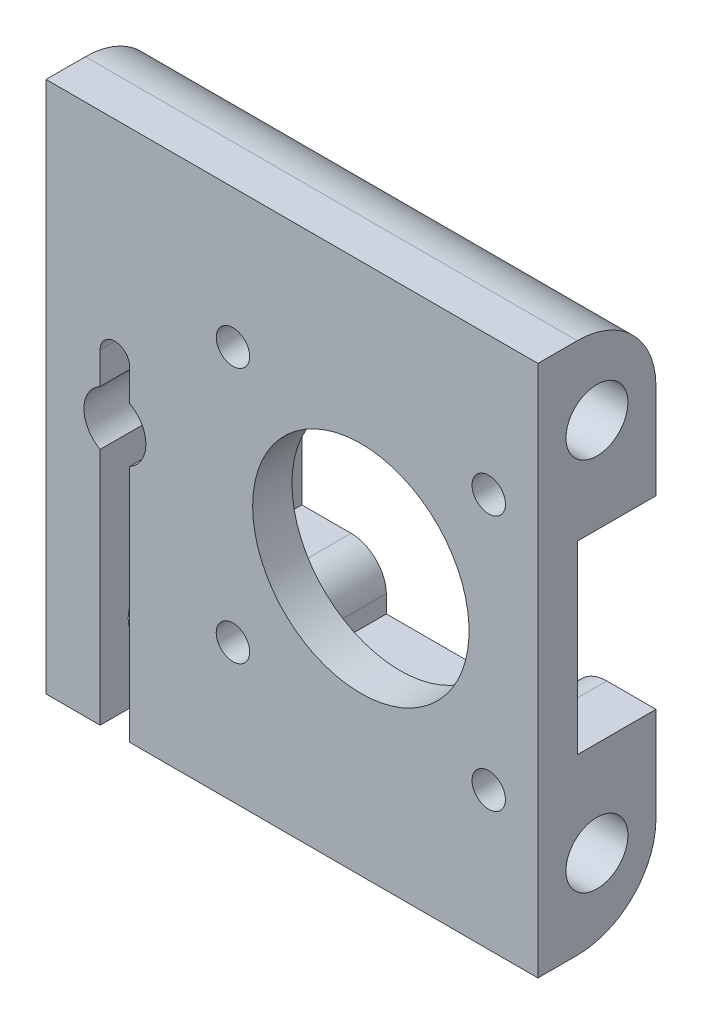
from build123d import *

# Parameters (mm, degrees)
SKETCH1_W           = 50
SKETCH1_H           = 54.105
BOSS_EXTRUDE1_DEPTH = 12
SKETCH2_R           = 3.15
CUT_EXTRUDE1_DEPTH  = 75.641483272
FILLET1_R           = 8
SKETCH3_R           = 11
SKETCH3_R_2         = 1.7
CUT_EXTRUDE2_DEPTH  = 75.641483272
CUT_EXTRUDE4_DEPTH  = 8


with BuildPart() as part:
    # Sketch1 → Boss-Extrude1 (new body)
    with BuildSketch(Plane.XY):
        with Locations((25, 27.0525)):
            Rectangle(SKETCH1_W, SKETCH1_H)
    extrude(amount=BOSS_EXTRUDE1_DEPTH)

    # Sketch2 → Cut-Extrude1 (cut, through all)
    with BuildSketch(Plane(origin=(0, 0, 0), x_dir=(0, 0, -1), z_dir=(1, 0, 0))):
        with Locations((-6, 46.105)):
            Circle(SKETCH2_R)
        with Locations(Location((-6, 8, 0), (0, 0, 180))):
            Circle(SKETCH2_R)
    extrude(amount=CUT_EXTRUDE1_DEPTH, mode=Mode.SUBTRACT)

    # Fillet1
    fillet1_edges = [part.edges().sort_by_distance(p)[0] for p in [
        (25, 54.105, 0),
        (25, 0, 0),
    ]]
    fillet(fillet1_edges, radius=FILLET1_R)

    # Sketch3 → Cut-Extrude2 (cut, through all)
    with BuildSketch(Plane(origin=(0, 0, 0), x_dir=(-1, 0, 0), z_dir=(0, 0, -1))):
        with Locations((-32, 27.0525)):
            Circle(SKETCH3_R)
        with Locations((-19, 40.0525)):
            Circle(SKETCH3_R_2)
        with Locations((-19, 14.0525)):
            Circle(SKETCH3_R_2)
        with Locations((-45, 14.0525)):
            Circle(SKETCH3_R_2)
        with Locations((-45, 40.0525)):
            Circle(SKETCH3_R_2)
        with BuildLine():
            Line((-8.5, 0), (-8.5, 24.282572203))
            ThreePointArc((-8.5, 24.282572203), (-10.15, 27.0525), (-8.5, 29.822427797))
            Line((-8.5, 29.822427797), (-8.5, 33.0525))
            ThreePointArc((-8.5, 33.0525), (-7, 34.5525), (-5.5, 33.0525))
            Line((-5.5, 33.0525), (-5.5, 29.822427797))
            ThreePointArc((-5.5, 29.822427797), (-3.85, 27.0525), (-5.5, 24.282572203))
            Line((-5.5, 24.282572203), (-5.5, 0))
            Line((-5.5, 0), (-8.5, 0))
        make_face()
    extrude(amount=-CUT_EXTRUDE2_DEPTH, mode=Mode.SUBTRACT)

    # Sketch5 → Cut-Extrude4 (cut)
    with BuildSketch(Plane(origin=(0, 0, 0), x_dir=(-1, 0, 0), z_dir=(0, 0, -1))):
        with BuildLine():
            Line((-19, 17.6525), (-14, 17.6525))
            Line((-14, 17.6525), (-14, 36.4525))
            Line((-14, 36.4525), (-19, 36.4525))
            ThreePointArc((-19, 36.4525), (-21.510876341, 37.472674425), (-22.598679445, 39.955))
            Line((-22.598679445, 39.955), (-22.598679445, 41.7525))
            Line((-22.598679445, 41.7525), (-41.401320555, 41.7525))
            Line((-41.401320555, 41.7525), (-41.401320555, 39.955))
            ThreePointArc((-41.401320555, 39.955), (-42.489123659, 37.472674425), (-45, 36.4525))
            Line((-45, 36.4525), (-50, 36.4525))
            Line((-50, 36.4525), (-50, 17.6525))
            Line((-50, 17.6525), (-45, 17.6525))
            ThreePointArc((-45, 17.6525), (-42.489123659, 16.632325575), (-41.401320555, 14.15))
            Line((-41.401320555, 14.15), (-41.401320555, 12.3525))
            Line((-41.401320555, 12.3525), (-22.598679445, 12.3525))
            Line((-22.598679445, 12.3525), (-22.598679445, 14.15))
            ThreePointArc((-22.598679445, 14.15), (-21.510876341, 16.632325575), (-19, 17.6525))
        make_face()
    extrude(amount=-CUT_EXTRUDE4_DEPTH, mode=Mode.SUBTRACT)


solid = part.part
